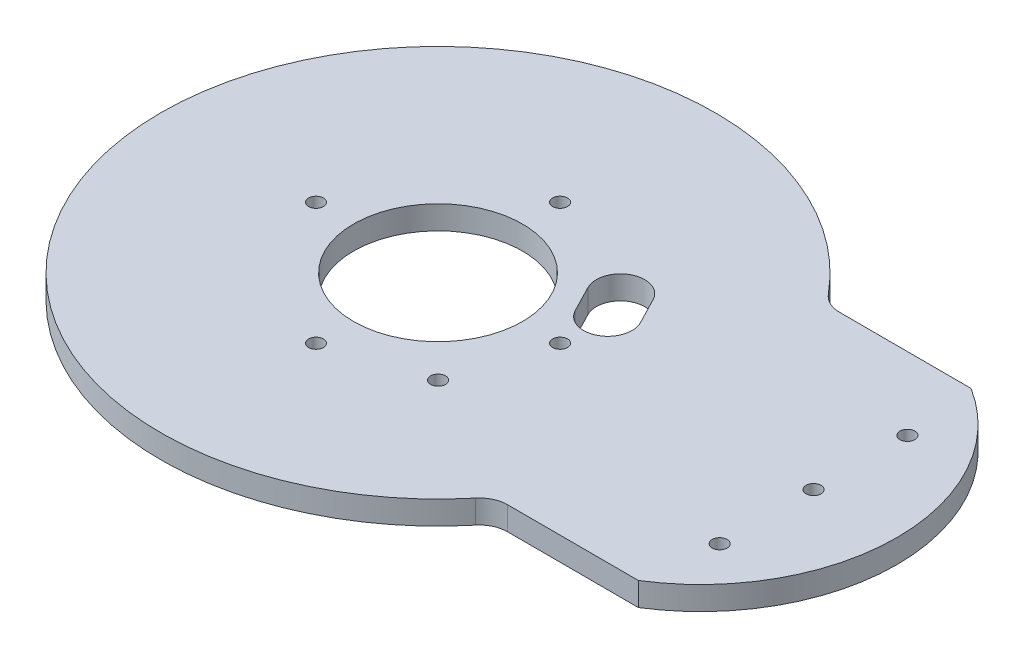
from build123d import *

# Parameters (mm, degrees)
SKETCH1_R                   = 2.0193
BOSS_EXTRUDE1_DEPTH         = 6.35
SKETCH16_R                  = 22.86
SKETCH16_R_2                = 2.0193
CUT_EXTRUDE1_DEPTH          = 6.35
FILLET1_R                   = 7.62
F_21_0_159_DIAMETER_HOLE1_D = 4.0386
CUT_EXTRUDE2_DEPTH          = 168.826775285
CUT_EXTRUDE3_DEPTH          = 168.826775285


with BuildPart() as part:
    # Sketch1 → Boss-Extrude1 (new body)
    with BuildSketch(Plane(origin=(0, 0, 0), x_dir=(1, 0, 0), z_dir=(0, 1, 0))):
        with BuildLine():
            Line((24.199172761, -44.999955873), (-14.950739381, -44.936113543))
            ThreePointArc((-14.950739381, -44.936113543), (-150.001077441, -0.07990002), (-15.0466181, 45.063954554))
            Line((-15.0466181, 45.063954554), (24.199172761, 44.999955873))
            ThreePointArc((24.199172761, 44.999955873), (71.663954553, 0), (24.199172761, -44.999955873))
        make_face()
        with Locations(Location((26.6, 0, 0), (0, 0, 270))):
            Circle(SKETCH1_R, mode=Mode.SUBTRACT)
    extrude(amount=BOSS_EXTRUDE1_DEPTH)

    # Sketch16 → Cut-Extrude1 (cut)
    with BuildSketch(Plane(origin=(0.964771866, 6.35, 105.934324836), x_dir=(-1, 0, 0), z_dir=(0, 1, 0))):
        with Locations(Location((75.964771866, -105.934324836, 0), (0, 0, 90))):
            Circle(SKETCH16_R)
        with Locations(Location((50.800979112, -80.770532082, 0), (0, 0, 90))):
            Circle(SKETCH16_R_2)
        with Locations(Location((42.944771866, -105.934324836, 0), (0, 0, 90))):
            Circle(SKETCH16_R_2)
        with Locations(Location((75.964771866, -72.914324836, 0), (0, 0, 90))):
            Circle(SKETCH16_R_2)
        with Locations(Location((108.984771866, -105.934324836, 0), (0, 0, 90))):
            Circle(SKETCH16_R_2)
        with Locations(Location((75.964771866, -138.954324836, 0), (0, 0, 90))):
            Circle(SKETCH16_R_2)
    extrude(amount=-CUT_EXTRUDE1_DEPTH, mode=Mode.SUBTRACT)

    # Fillet1
    fillet1_edges = [part.edges().sort_by_distance(p)[0] for p in [
        (-15.0466181, 3.175, -45.063954554),
        (-14.950739381, 3.175, 44.936113543),
    ]]
    fillet(fillet1_edges, radius=FILLET1_R)

    # #21 (0.159) Diameter Hole1 (through all)
    with Locations(Plane(origin=(0, 6.35, 0), x_dir=(1, 0, 0), z_dir=(0, 1, 0))):
        with Locations((26.6, 25.4), (26.6, -25.4)):
            Hole(F_21_0_159_DIAMETER_HOLE1_D / 2)

    # Sketch19 → Cut-Extrude2 (cut, through all)
    with BuildSketch(Plane(origin=(0, 6.35, 0), x_dir=(1, 0, 0), z_dir=(0, 1, 0))):
        with BuildLine():
            ThreePointArc((24.199172761, 44.999955873), (49.131977277, 0), (24.199172761, -44.999955873))
            ThreePointArc((24.199172761, -44.999955873), (71.663954553, 0), (24.199172761, 44.999955873))
        make_face()
    extrude(amount=-CUT_EXTRUDE2_DEPTH, mode=Mode.SUBTRACT)

    # Sketch20 → Cut-Extrude3 (cut, through all)
    with BuildSketch(Plane(origin=(0, 6.35, 0), x_dir=(1, 0, 0), z_dir=(0, 1, 0))):
        with BuildLine():
            Line((-39.61253295, 22.813806704), (-35.939374007, 15.716554888))
            ThreePointArc((-35.939374007, 15.716554888), (-38.746700574, 6.886169325), (-47.577086137, 9.693495892))
            Line((-47.577086137, 9.693495892), (-51.25024508, 16.790747709))
            ThreePointArc((-51.25024508, 16.790747709), (-48.442918513, 25.621133271), (-39.61253295, 22.813806704))
        make_face()
    extrude(amount=-CUT_EXTRUDE3_DEPTH, mode=Mode.SUBTRACT)


solid = part.part
